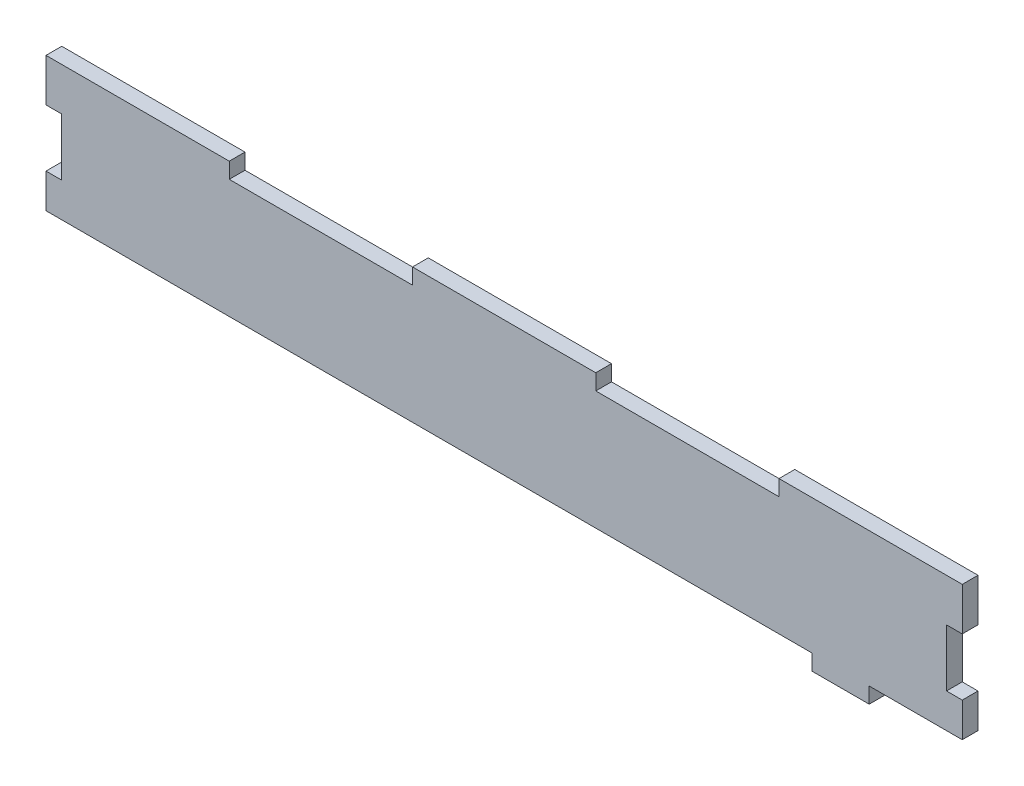
from build123d import *

# Parameters (mm, degrees)
SALIENTE_EXTRUIR1_DEPTH = 5.5


with BuildPart() as part:
    # Croquis1 → Saliente-Extruir1 (new body)
    with BuildSketch(Plane.XY):
        Polygon((-63.776750848, 3.308342792), (-63.776750848, 15.308342792), (-58.276750848, 15.308342792), (-58.276750848, 35.308342792), (-63.776750848, 35.308342792), (-63.776750848, 50.308342792), (0.223249152, 50.308342792), (0.223249152, 44.808342792), (64.223249152, 44.808342792), (64.223249152, 50.308342792), (128.223249152, 50.308342792), (128.223249152, 44.808342792), (192.223249152, 44.808342792), (192.223249152, 50.308342792), (256.223249152, 50.308342792), (256.223249152, 35.308342792), (250.723249152, 35.308342792), (250.723249152, 15.308342792), (256.223249152, 15.308342792), (256.223249152, 3.308342792), (223.723249152, 3.308342792), (223.723249152, -2.191657208), (203.723249152, -2.191657208), (203.723249152, 3.308342792), align=None)
    extrude(amount=SALIENTE_EXTRUIR1_DEPTH)


solid = part.part
